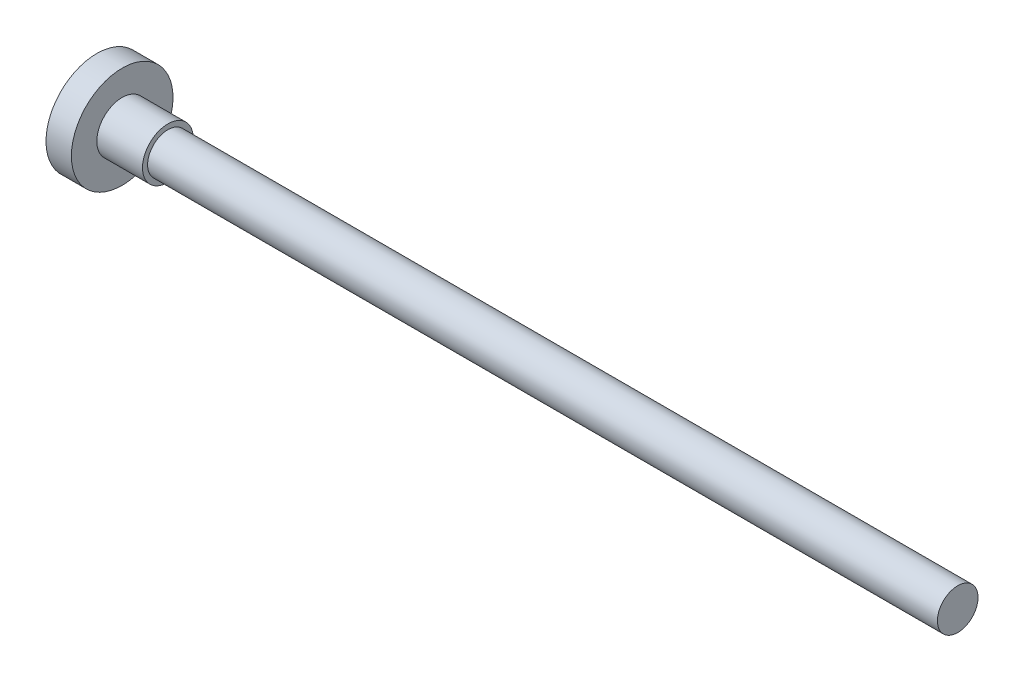
from build123d import *


with BuildPart() as part:
    # 草图1 → 旋转1 (revolve)
    with BuildSketch(Plane(origin=(0, 0, 0), x_dir=(1, 0, 0), z_dir=(0, 1, 0)), mode=Mode.PRIVATE) as revolve_1_sk:
        Polygon((0, 0), (0, 10), (5, 10), (5, 5), (14, 5), (14, 4), (169.5, 4), (169.5, 0), align=None)
    revolve(revolve_1_sk.sketch.rotate(Axis((-88.415848436, 0, 0), (1, 0, 0)), 180), axis=Axis((-88.415848436, 0, 0), (1, 0, 0)))


solid = part.part
